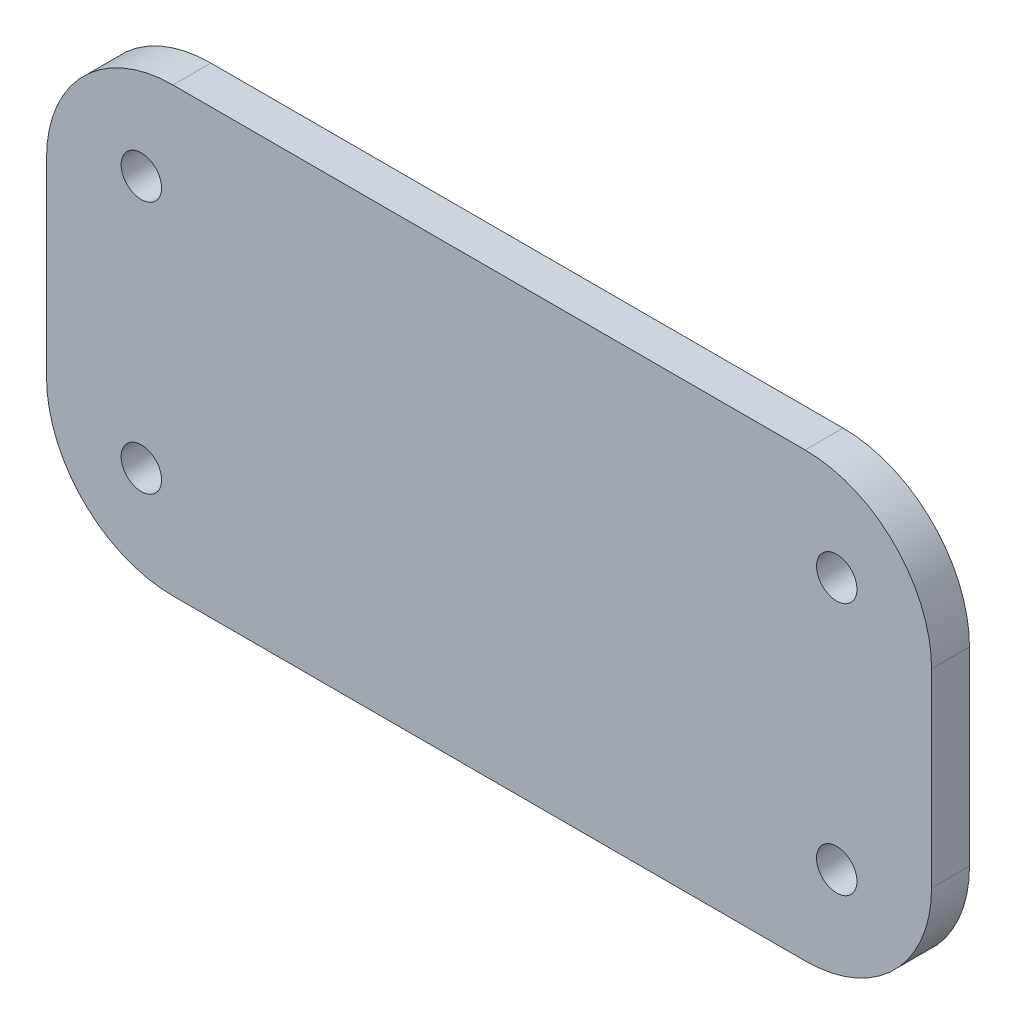
from build123d import *

# Parameters (mm, degrees)
SKETCH_1_W      = 70
SKETCH_1_H      = 35
SKETCH_1_R      = 1.6
EXTRUDE_1_DEPTH = 3
FILLET_1_R      = 10


with BuildPart() as part:
    # 草图1 → 凸台-拉伸1 (new body)
    with BuildSketch(Plane.XY):
        Rectangle(SKETCH_1_W, SKETCH_1_H)
        with Locations((-27.5, 10)):
            Circle(SKETCH_1_R, mode=Mode.SUBTRACT)
        with Locations((-27.5, -10)):
            Circle(SKETCH_1_R, mode=Mode.SUBTRACT)
        with Locations((27.5, -10)):
            Circle(SKETCH_1_R, mode=Mode.SUBTRACT)
        with Locations((27.5, 10)):
            Circle(SKETCH_1_R, mode=Mode.SUBTRACT)
    extrude(amount=EXTRUDE_1_DEPTH)

    # 圆角1
    fillet_1_edges = [part.edges().sort_by_distance(p)[0] for p in [
        (35, -17.5, 1.5),
        (-35, -17.5, 1.5),
        (-35, 17.5, 1.5),
        (35, 17.5, 1.5),
    ]]
    fillet(fillet_1_edges, radius=FILLET_1_R)


solid = part.part
